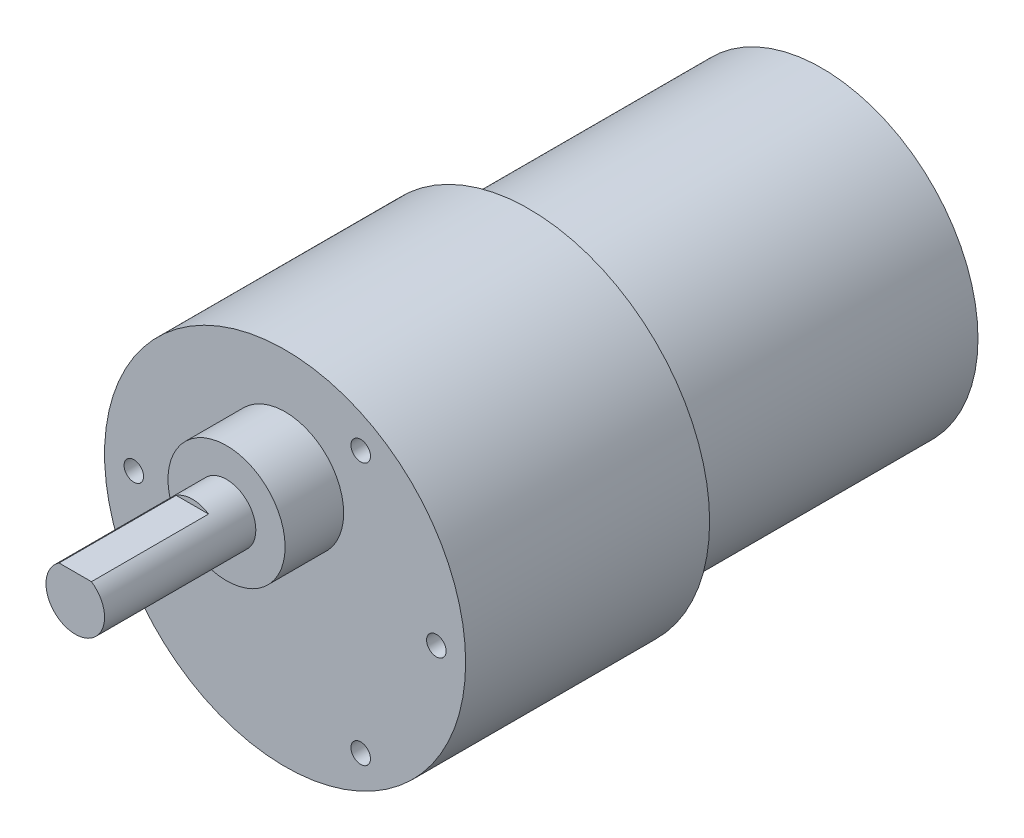
from build123d import *

# Parameters (mm, degrees)
ESQUISSE1_R             = 16
BOSS_EXTRU_2_DEPTH      = 30
ESQUISSE2_R             = 18.5
BOSS_EXTRU_3_DEPTH      = 25
ESQUISSE3_R             = 1
ENL_V_MAT_EXTRU_1_DEPTH = 3.5
ESQUISSE5_R             = 6
BOSS_EXTRU_4_DEPTH      = 6
ESQUISSE6_R             = 3
BOSS_EXTRU_5_DEPTH      = 15.5
ESQUISSE7_W             = 7.308646468
ESQUISSE7_H             = 1
ENL_V_MAT_EXTRU_2_DEPTH = 12


with BuildPart() as part:
    # Esquisse1 → Boss.-Extru.2 (new body)
    with BuildSketch(Plane.XY):
        Circle(ESQUISSE1_R)
    extrude(amount=BOSS_EXTRU_2_DEPTH)

    # Esquisse2 → Boss.-Extru.3 (add)
    with BuildSketch(Plane.XY.offset(30)):
        Circle(ESQUISSE2_R)
    extrude(amount=BOSS_EXTRU_3_DEPTH)

    # Esquisse3 → Enlèv. mat.-Extru.1 (cut)
    with BuildSketch(Plane.XY.offset(55)):
        with Locations(Location((-15.5, 0, 0), (0, 0, 180))):
            Circle(ESQUISSE3_R)
        with Locations(Location((7.75, -13.423393759, 0), (0, 0, 180))):
            Circle(ESQUISSE3_R)
        with Locations(Location((15.5, 0, 0), (0, 0, 180))):
            Circle(ESQUISSE3_R)
        with Locations(Location((7.75, 13.423393759, 0), (0, 0, 180))):
            Circle(ESQUISSE3_R)
    extrude(amount=-ENL_V_MAT_EXTRU_1_DEPTH, mode=Mode.SUBTRACT)

    # Esquisse5 → Boss.-Extru.4 (add)
    with BuildSketch(Plane.XY.offset(55)):
        with Locations((0, 7)):
            Circle(ESQUISSE5_R)
    extrude(amount=BOSS_EXTRU_4_DEPTH)

    # Esquisse6 → Boss.-Extru.5 (add)
    with BuildSketch(Plane.XY.offset(61)):
        with Locations((0, 7)):
            Circle(ESQUISSE6_R)
    extrude(amount=BOSS_EXTRU_5_DEPTH)

    # Esquisse7 → Enlèv. mat.-Extru.2 (cut)
    with BuildSketch(Plane.XY.offset(76.5)):
        with Locations((0, 10)):
            Rectangle(ESQUISSE7_W, ESQUISSE7_H)
    extrude(amount=-ENL_V_MAT_EXTRU_2_DEPTH, mode=Mode.SUBTRACT)


solid = part.part
